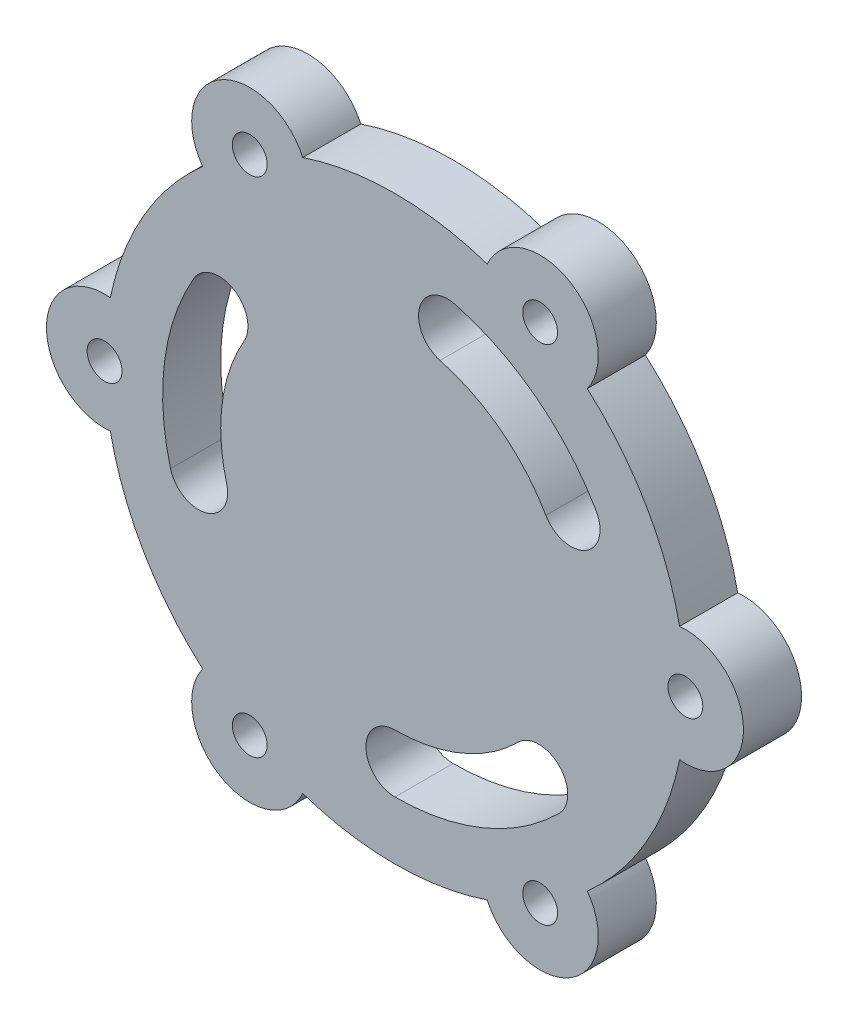
from build123d import *

# Parameters (mm, degrees)
SKETCH1_R           = 3
BOSS_EXTRUDE1_DEPTH = 10


with BuildPart() as part:
    # Sketch1 → Boss-Extrude1 (new body)
    with BuildSketch(Plane.XY):
        with BuildLine():
            ThreePointArc((49, 9.949874371), (43.301270189, 25), (33.11684397, 37.4603076))
            ThreePointArc((33.11684397, 37.4603076), (30, 51.961524227), (15.88315603, 47.410181971))
            ThreePointArc((15.88315603, 47.410181971), (0, 50), (-15.88315603, 47.410181971))
            ThreePointArc((-15.88315603, 47.410181971), (-30, 51.961524227), (-33.11684397, 37.4603076))
            ThreePointArc((-33.11684397, 37.4603076), (-43.301270189, 25), (-49, 9.949874371))
            ThreePointArc((-49, 9.949874371), (-60, 0), (-49, -9.949874371))
            ThreePointArc((-49, -9.949874371), (-43.301270189, -25), (-33.11684397, -37.4603076))
            ThreePointArc((-33.11684397, -37.4603076), (-30, -51.961524227), (-15.88315603, -47.410181971))
            ThreePointArc((-15.88315603, -47.410181971), (0, -50), (15.88315603, -47.410181971))
            ThreePointArc((15.88315603, -47.410181971), (30, -51.961524227), (33.11684397, -37.4603076))
            ThreePointArc((33.11684397, -37.4603076), (43.301270189, -25), (49, -9.949874371))
            ThreePointArc((49, -9.949874371), (60, 0), (49, 9.949874371))
        make_face()
        with Locations((50, 0)):
            Circle(SKETCH1_R, mode=Mode.SUBTRACT)
        with Locations((25, -43.301270189)):
            Circle(SKETCH1_R, mode=Mode.SUBTRACT)
        with Locations((-25, -43.301270189)):
            Circle(SKETCH1_R, mode=Mode.SUBTRACT)
        with Locations((-50, 0)):
            Circle(SKETCH1_R, mode=Mode.SUBTRACT)
        with Locations((-25, 43.301270189)):
            Circle(SKETCH1_R, mode=Mode.SUBTRACT)
        with Locations((25, 43.301270189)):
            Circle(SKETCH1_R, mode=Mode.SUBTRACT)
        with BuildLine():
            ThreePointArc((34.641016151, 20), (24.35045716, 31.734133612), (10.352761804, 38.637033052))
            ThreePointArc((10.352761804, 38.637033052), (4.229037447, 35.101499146), (7.764571353, 28.977774789))
            ThreePointArc((7.764571353, 28.977774789), (18.26284287, 23.800600209), (25.980762114, 15))
            ThreePointArc((25.980762114, 15), (32.810889132, 13.169872981), (34.641016151, 20))
        make_face(mode=Mode.SUBTRACT)
        with BuildLine():
            ThreePointArc((0, -40), (15.307337295, -36.9551813), (28.284271247, -28.284271247))
            ThreePointArc((28.284271247, -28.284271247), (28.284271247, -21.213203436), (21.213203436, -21.213203436))
            ThreePointArc((21.213203436, -21.213203436), (11.480502971, -27.716385975), (0, -30))
            ThreePointArc((0, -30), (-5, -35), (0, -40))
        make_face(mode=Mode.SUBTRACT)
        with BuildLine():
            ThreePointArc((-34.641016151, 20), (-39.657794455, 5.221047689), (-38.637033052, -10.352761804))
            ThreePointArc((-38.637033052, -10.352761804), (-32.513308695, -13.88829571), (-28.977774789, -7.764571353))
            ThreePointArc((-28.977774789, -7.764571353), (-29.743345841, 3.915785767), (-25.980762114, 15))
            ThreePointArc((-25.980762114, 15), (-27.810889132, 21.830127019), (-34.641016151, 20))
        make_face(mode=Mode.SUBTRACT)
    extrude(amount=BOSS_EXTRUDE1_DEPTH)


solid = part.part
